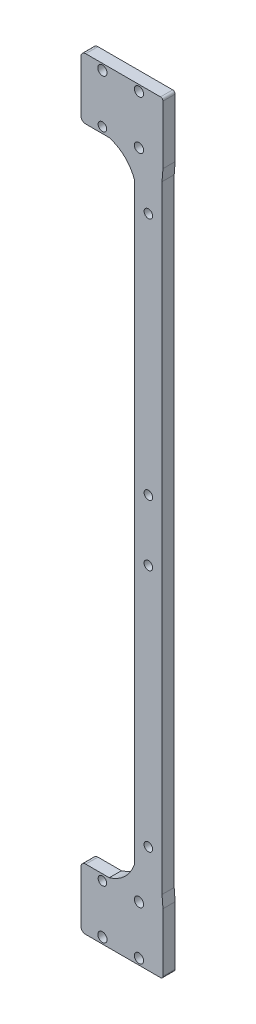
from build123d import *

# Parameters (mm, degrees)
SKETCH1_R           = 1.9
SKETCH1_R_2         = 1.75
BOSS_EXTRUDE1_DEPTH = 5


with BuildPart() as part:
    # Sketch1 → Boss-Extrude1 (new body)
    with BuildSketch(Plane.XY):
        with BuildLine():
            Line((22.7, -12.5), (33.7, -12.5))
            ThreePointArc((33.7, -12.5), (34.407106781, -12.207106781), (34.7, -11.5))
            Line((34.7, -11.5), (34.7, 12.5))
            add(Edge.make_bspline(
                [(34.3, 17.348309182), (34.529755129, 14.926573724), (34.7, 12.5)],
                knots=[0, 0, 0, 1, 1, 1], degree=2))
            Line((34.3, 17.348309182), (34.3, 270.651690818))
            add(Edge.make_bspline(
                [(34.3, 270.651690818), (34.529755129, 273.073426276), (34.7, 275.5)],
                knots=[0, 0, 0, 1, 1, 1], degree=2))
            Line((34.7, 275.5), (34.7, 299.5))
            ThreePointArc((34.7, 299.5), (34.407106781, 300.207106781), (33.7, 300.5))
            Line((33.7, 300.5), (22.7, 300.5))
            Line((22.7, 300.5), (3, 300.5))
            ThreePointArc((3, 300.5), (1.585786438, 299.914213562), (1, 298.5))
            Line((1, 298.5), (1, 277.5))
            ThreePointArc((1, 277.5), (1.585786438, 276.085786438), (3, 275.5))
            Line((3, 275.5), (12.676771392, 275.5))
            add(Edge.make_bspline(
                [(23.1, 265.447646174), (20.336020381, 273.078870877), (12.676771392, 275.5)],
                knots=[0, 0, 0, 1, 1, 1], degree=2))
            Line((23.1, 265.447646174), (23.1, 22.552353826))
            add(Edge.make_bspline(
                [(23.1, 22.552353826), (20.336020381, 14.921129123), (12.676771392, 12.5)],
                knots=[0, 0, 0, 1, 1, 1], degree=2))
            Line((12.676771392, 12.5), (3, 12.5))
            ThreePointArc((3, 12.5), (1.585786438, 11.914213562), (1, 10.5))
            Line((1, 10.5), (1, -10.5))
            ThreePointArc((1, -10.5), (1.585786438, -11.914213562), (3, -12.5))
            Line((3, -12.5), (22.7, -12.5))
        make_face()
        with Locations((9.85, -10)):
            Circle(SKETCH1_R, mode=Mode.SUBTRACT)
        with Locations((9.85, 10)):
            Circle(SKETCH1_R_2, mode=Mode.SUBTRACT)
        with Locations((24.85, 10)):
            Circle(SKETCH1_R, mode=Mode.SUBTRACT)
        with Locations((24.85, -10)):
            Circle(SKETCH1_R, mode=Mode.SUBTRACT)
        with Locations((28.7, 131.5)):
            Circle(SKETCH1_R_2, mode=Mode.SUBTRACT)
        with Locations((28.7, 156.5)):
            Circle(SKETCH1_R_2, mode=Mode.SUBTRACT)
        with Locations((28.7, 256.5)):
            Circle(SKETCH1_R_2, mode=Mode.SUBTRACT)
        with Locations((28.7, 31.5)):
            Circle(SKETCH1_R_2, mode=Mode.SUBTRACT)
        with Locations(Location((24.85, 298, 0), (0, 0, 180))):
            Circle(SKETCH1_R, mode=Mode.SUBTRACT)
        with Locations(Location((24.85, 278, 0), (0, 0, 180))):
            Circle(SKETCH1_R, mode=Mode.SUBTRACT)
        with Locations(Location((9.85, 278, 0), (0, 0, 180))):
            Circle(SKETCH1_R_2, mode=Mode.SUBTRACT)
        with Locations(Location((9.85, 298, 0), (0, 0, 180))):
            Circle(SKETCH1_R, mode=Mode.SUBTRACT)
    extrude(amount=BOSS_EXTRUDE1_DEPTH)


solid = part.part
